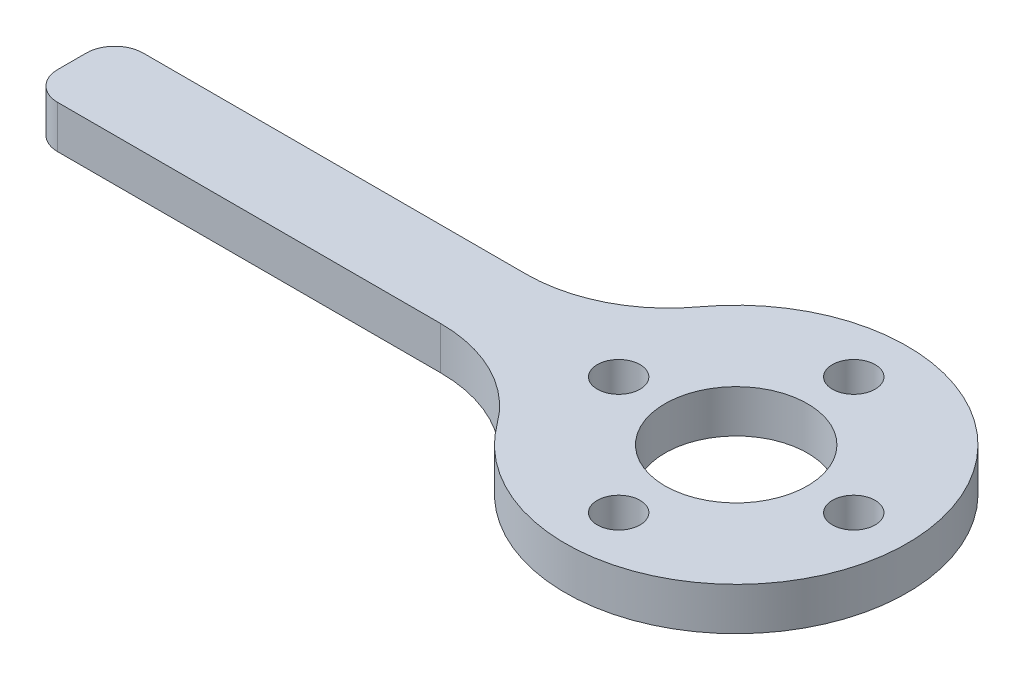
from build123d import *

# Parameters (mm, degrees)
SKETCH_1_R          = 5
EXTRUDE_1_DEPTH     = 3
SKETCH_2_R          = 1.5
CUT_EXTRUDE_1_DEPTH = 49.232007036
FILLET_1_R          = 2
FILLET_2_R          = 10


with BuildPart() as part:
    # 草图1 → 凸台-拉伸1 (new body)
    with BuildSketch(Plane(origin=(0, 0, 0), x_dir=(1, 0, 0), z_dir=(0, 1, 0))):
        with BuildLine():
            Line((-11.618950039, -3), (-46.618950039, -3))
            Line((-46.618950039, -3), (-46.618950039, 3))
            Line((-46.618950039, 3), (-11.618950039, 3))
            ThreePointArc((-11.618950039, 3), (12, 0), (-11.618950039, -3))
        make_face()
        with Locations(Location((0, 0, 0), (0, 0, 270))):
            Circle(SKETCH_1_R, mode=Mode.SUBTRACT)
    extrude(amount=EXTRUDE_1_DEPTH)

    # 草图2 → 切除-拉伸1 (cut, through all)
    with BuildSketch(Plane(origin=(0, 3, 0), x_dir=(1, 0, 0), z_dir=(0, 1, 0))):
        with Locations(Location((0, 8.25, 0), (0, 0, 270))):
            Circle(SKETCH_2_R)
        with Locations(Location((8.25, 0, 0), (0, 0, 270))):
            Circle(SKETCH_2_R)
        with Locations(Location((0, -8.25, 0), (0, 0, 270))):
            Circle(SKETCH_2_R)
        with Locations(Location((-8.25, 0, 0), (0, 0, 270))):
            Circle(SKETCH_2_R)
    extrude(amount=-CUT_EXTRUDE_1_DEPTH, mode=Mode.SUBTRACT)

    # 圆角1
    fillet_1_edges = [part.edges().sort_by_distance(p)[0] for p in [
        (-46.618950039, 1.5, 3),
        (-46.618950039, 1.5, -3),
    ]]
    fillet(fillet_1_edges, radius=FILLET_1_R)

    # 圆角2
    fillet_2_edges = [part.edges().sort_by_distance(p)[0] for p in [
        (-11.618950039, 1.5, 3),
        (-11.618950039, 1.5, -3),
    ]]
    fillet(fillet_2_edges, radius=FILLET_2_R)


solid = part.part
